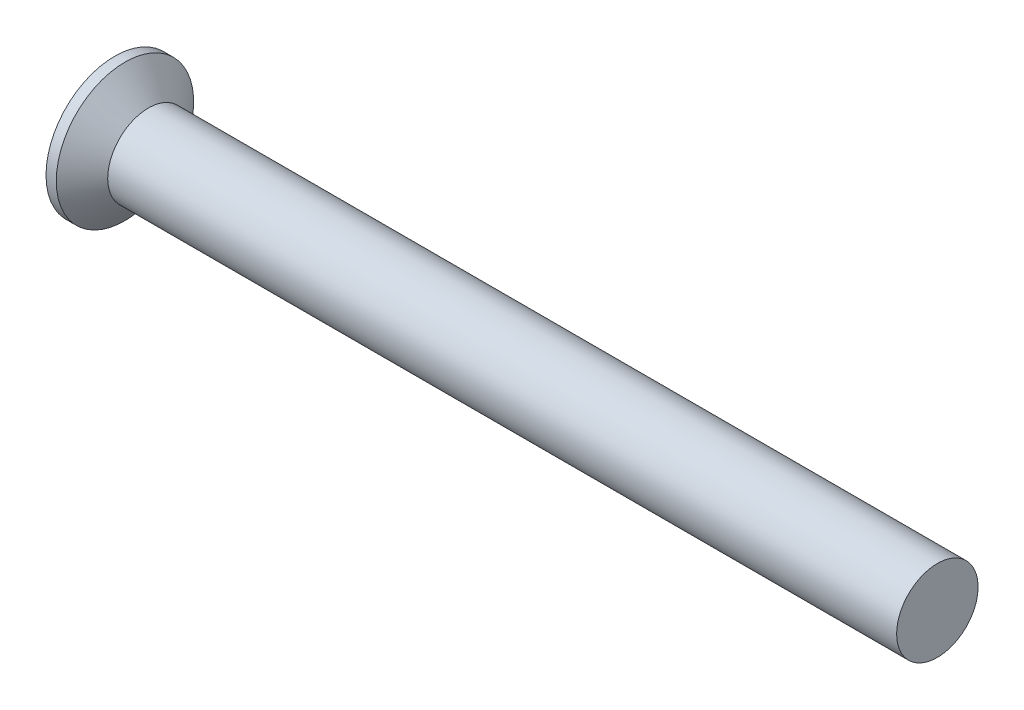
from build123d import *

# Parameters (mm, degrees)
CIRPATTERN1_COUNT = 2
CIRPATTERN1_ANGLE = 90


with BuildPart() as part:
    # BodySke → Base-Revolve (revolve)
    with BuildSketch(Plane.XY, mode=Mode.PRIVATE) as base_revolve_sk:
        Polygon((0, 0), (0, 2.1209), (0.316753559, 2.1209), (1.0414, 1.2573), (25.4, 1.2573), (25.4, 0), align=None)
    revolve(base_revolve_sk.sketch.rotate(Axis((-6.35, 0, 0), (1, 0, 0)), 90), axis=Axis((-6.35, 0, 0), (1, 0, 0)))

    # Sketch3 → Cross section 0
    with BuildSketch(Plane.ZY):
        with BuildLine():
            Line((-0.3429, 1.4986), (0.3429, 1.4986))
            Line((0.3429, 1.4986), (0.3429, -1.4986))
            Line((0.3429, -1.4986), (-0.3429, -1.4986))
            Line((-0.3429, -1.4986), (-0.3429, 1.4986))
        make_face()
    # Sketch4 → Cross section 1
    with BuildSketch(Plane.ZY.offset(-1.9558)):
        with BuildLine():
            Line((-0.17145, 0.17145), (0.17145, 0.17145))
            Line((0.17145, 0.17145), (0.17145, -0.17145))
            Line((0.17145, -0.17145), (-0.17145, -0.17145))
            Line((-0.17145, -0.17145), (-0.17145, 0.17145))
        make_face()
    cross = loft(mode=Mode.SUBTRACT)

    # CirPattern1: Cross ×2 about axis
    cirpattern1_axis = Axis((0, 0, 0), (1, 0, 0))
    for i in range(1, CIRPATTERN1_COUNT):
        add(cross.rotate(cirpattern1_axis, i * CIRPATTERN1_ANGLE / (CIRPATTERN1_COUNT - 1)), mode=Mode.SUBTRACT)


solid = part.part
